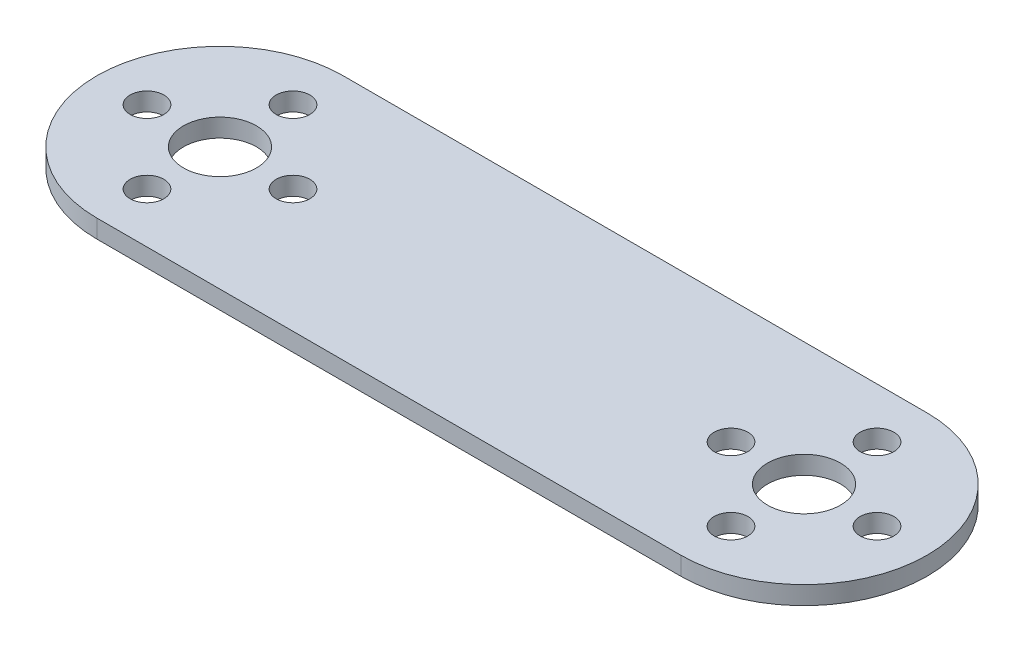
from build123d import *

# Parameters (mm, degrees)
SKETCH1_R           = 1.85
SKETCH1_R_2         = 4
BOSS_EXTRUDE1_DEPTH = 2


with BuildPart() as part:
    # Sketch1 → Boss-Extrude1 (new body)
    with BuildSketch(Plane(origin=(0, 2, 0), x_dir=(1, 0, 0), z_dir=(0, 1, 0))):
        with BuildLine():
            Line((64, 13.5), (0, 13.5))
            ThreePointArc((0, 13.5), (-13.5, 0), (0, -13.5))
            Line((0, -13.5), (64, -13.5))
            ThreePointArc((64, -13.5), (77.5, 0), (64, 13.5))
        make_face()
        with Locations(Location((56, 0, 0), (0, 0, 90))):
            Circle(SKETCH1_R, mode=Mode.SUBTRACT)
        with Locations(Location((64, -8, 0), (0, 0, 90))):
            Circle(SKETCH1_R, mode=Mode.SUBTRACT)
        with Locations(Location((72, 0, 0), (0, 0, 90))):
            Circle(SKETCH1_R, mode=Mode.SUBTRACT)
        with Locations(Location((64, 8, 0), (0, 0, 90))):
            Circle(SKETCH1_R, mode=Mode.SUBTRACT)
        with Locations(Location((64, 0, 0), (0, 0, 90))):
            Circle(SKETCH1_R_2, mode=Mode.SUBTRACT)
        with Locations(Location((-8, 0, 0), (0, 0, 90))):
            Circle(SKETCH1_R, mode=Mode.SUBTRACT)
        with Locations(Location((0, -8, 0), (0, 0, 90))):
            Circle(SKETCH1_R, mode=Mode.SUBTRACT)
        with Locations(Location((8, 0, 0), (0, 0, 90))):
            Circle(SKETCH1_R, mode=Mode.SUBTRACT)
        with Locations(Location((0, 8, 0), (0, 0, 90))):
            Circle(SKETCH1_R, mode=Mode.SUBTRACT)
        with Locations(Location((0, 0, 0), (0, 0, 90))):
            Circle(SKETCH1_R_2, mode=Mode.SUBTRACT)
    extrude(amount=-BOSS_EXTRUDE1_DEPTH)


solid = part.part
